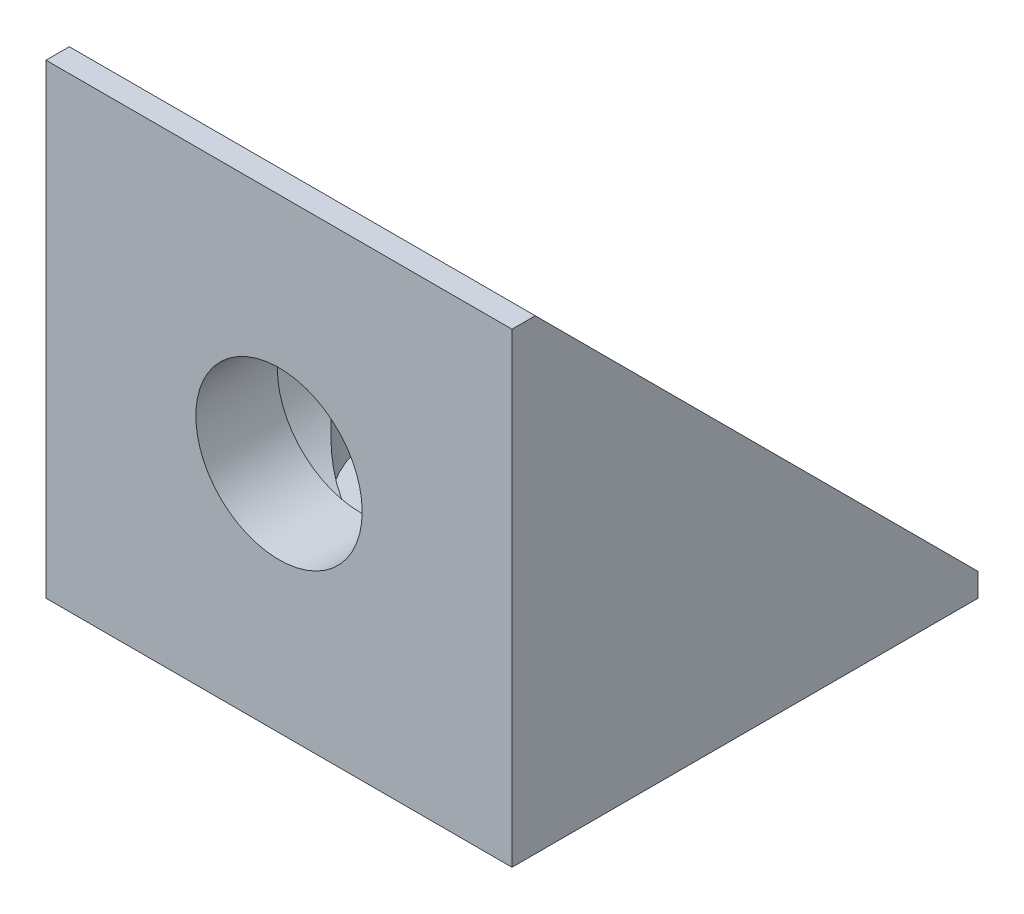
from build123d import *

# Parameters (mm, degrees)
BOSS_EXTRU_1_DEPTH      = 10
ESQUISSE2_R             = 3.57
ENL_V_MAT_EXTRU_1_DEPTH = 31
ESQUISSE3_R             = 5.5
ENL_V_MAT_EXTRU_2_DEPTH = 16.5
ESQUISSE5_R             = 3.57
ENL_V_MAT_EXTRU_3_DEPTH = 31
ESQUISSE6_R             = 5.5
ENL_V_MAT_EXTRU_4_DEPTH = 16.5


with BuildPart() as part:
    # Esquisse1 → Boss.-Extru.1 (new, symmetric)
    with BuildSketch(Plane(origin=(0, 0, 0), x_dir=(0, 0, -1), z_dir=(1, 0, 0))):
        Polygon((20, 0), (0, 0), (0, 20), (1, 20), (20, 1), align=None)
    extrude(amount=BOSS_EXTRU_1_DEPTH, both=True)

    # Esquisse2 → Enlèv. mat.-Extru.1 (cut, through all)
    with BuildSketch(Plane.XZ):
        with Locations(Location((0, -10, 0), (0, 0, 270))):
            Circle(ESQUISSE2_R)
    extrude(amount=-ENL_V_MAT_EXTRU_1_DEPTH, mode=Mode.SUBTRACT)

    # Esquisse3 → Enlèv. mat.-Extru.2 (cut)
    with BuildSketch(Plane(origin=(0, 20, 0), x_dir=(1, 0, 0), z_dir=(0, 1, 0))):
        with Locations(Location((0, 10, 0), (0, 0, 270))):
            Circle(ESQUISSE3_R)
    extrude(amount=-ENL_V_MAT_EXTRU_2_DEPTH, mode=Mode.SUBTRACT)

    # Esquisse5 → Enlèv. mat.-Extru.3 (cut, through all)
    with BuildSketch(Plane.XY):
        with Locations((0, 10)):
            Circle(ESQUISSE5_R)
    extrude(amount=-ENL_V_MAT_EXTRU_3_DEPTH, mode=Mode.SUBTRACT)

    # Esquisse6 → Enlèv. mat.-Extru.4 (cut)
    with BuildSketch(Plane(origin=(0, 0, -20), x_dir=(-1, 0, 0), z_dir=(0, 0, -1))):
        with Locations((0, 10)):
            Circle(ESQUISSE6_R)
    extrude(amount=-ENL_V_MAT_EXTRU_4_DEPTH, mode=Mode.SUBTRACT)


solid = part.part
